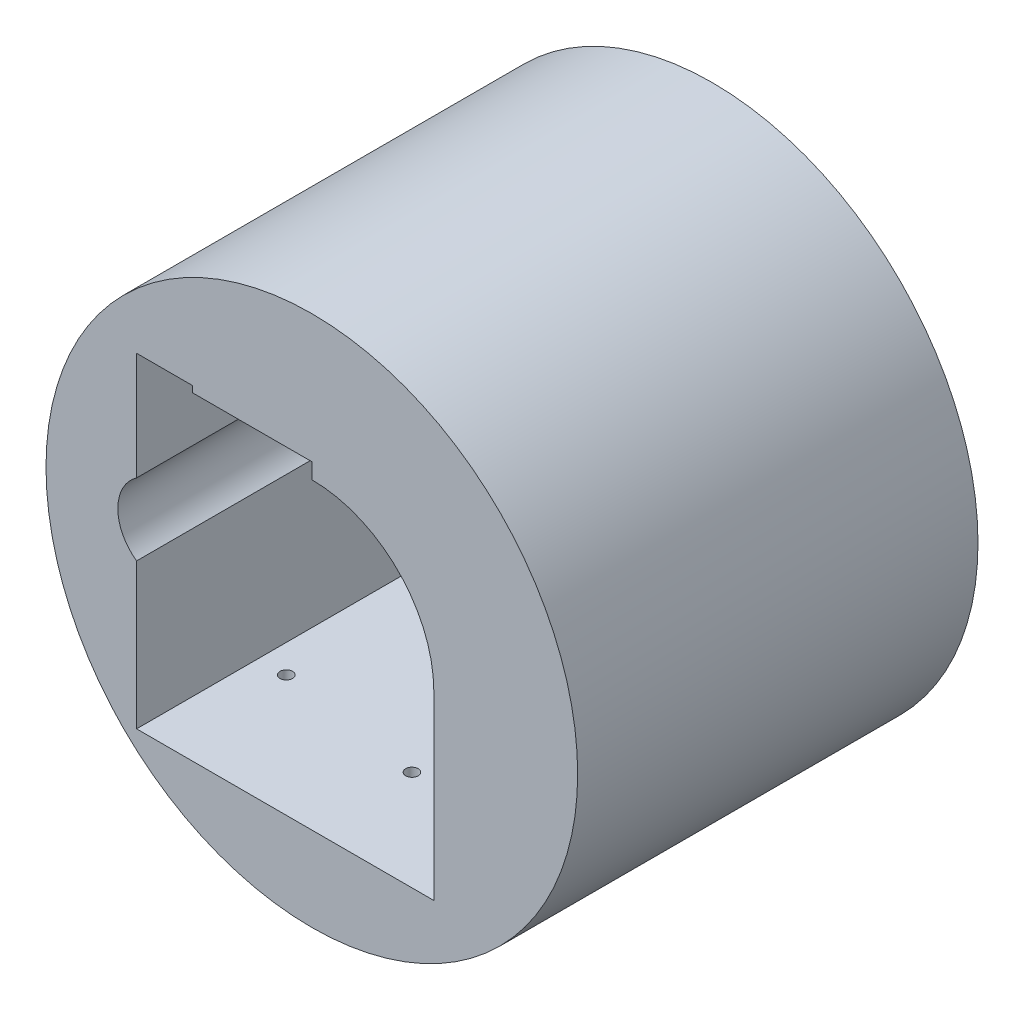
from build123d import *

# Parameters (mm, degrees)
SKETCH1_R           = 42.5
BOSS_EXTRUDE1_DEPTH = 64
SKETCH2_R           = 1
CUT_EXTRUDE1_DEPTH  = 13.5
SKETCH3_R           = 2.25
CUT_EXTRUDE2_DEPTH  = 5
SKETCH4_R           = 2.25
CUT_EXTRUDE3_DEPTH  = 12
CUT_EXTRUDE4_DEPTH  = 126.544655058


with BuildPart() as part:
    # Sketch1 → Boss-Extrude1 (new body)
    with BuildSketch(Plane(origin=(0, 0, -49.128748399), x_dir=(-1, 0, 0), z_dir=(0, 0, -1))):
        with Locations(Location((-41.816133513, 25, 0), (0, 0, 90))):
            Circle(SKETCH1_R)
        with BuildLine():
            Line((-13.801141106, 15.83484861), (-13.801141106, -4))
            Line((-13.801141106, -4), (-61.316133513, -4))
            Line((-61.316133513, -4), (-61.316133513, 25))
            ThreePointArc((-61.316133513, 25), (-55.604715746, 38.788582233), (-41.816133513, 44.5))
            Line((-41.816133513, 44.5), (-41.816133513, 47.000001781))
            Line((-41.816133513, 47.000001781), (-13.801141106, 47.000001781))
            Line((-13.801141106, 47.000001781), (-13.801141106, 34.16515139))
            Line((-13.801141106, 34.16515139), (-13.801141106, 30.744562647))
            ThreePointArc((-13.801141106, 30.744562647), (-10.801141106, 25), (-13.801141106, 19.255437353))
            Line((-13.801141106, 19.255437353), (-13.801141106, 15.83484861))
        make_face(mode=Mode.SUBTRACT)
    extrude(amount=-BOSS_EXTRUDE1_DEPTH)

    # Sketch2 → Cut-Extrude1 (cut)
    with BuildSketch(Plane(origin=(0, -17.5, 0), x_dir=(-1, 0, 0), z_dir=(0, -1, 0))):
        with Locations(Location((-18.301141106, 4.557815864, 0), (0, 0, 90))):
            Circle(SKETCH2_R)
        with Locations(Location((-18.301141106, 32.557815864, 0), (0, 0, 90))):
            Circle(SKETCH2_R)
        with Locations(Location((-41.816133513, 1.128748399, 0), (0, 0, 90))):
            Circle(SKETCH2_R)
    extrude(amount=-CUT_EXTRUDE1_DEPTH, mode=Mode.SUBTRACT)

    # Sketch3 → Cut-Extrude2 (cut)
    with BuildSketch(Plane(origin=(0, -17.5, 0), x_dir=(-1, 0, 0), z_dir=(0, -1, 0))):
        with Locations(Location((-41.816133513, 1.128748399, 0), (0, 0, 90))):
            Circle(SKETCH3_R)
        with Locations((-18.301141106, 4.557815864)):
            Circle(SKETCH3_R)
        with Locations((-18.301141106, 32.557815864)):
            Circle(SKETCH3_R)
    extrude(amount=-CUT_EXTRUDE2_DEPTH, mode=Mode.SUBTRACT)

    # Sketch4 → Cut-Extrude3 (cut)
    with BuildSketch(Plane(origin=(0, -17.5, 0), x_dir=(-1, 0, 0), z_dir=(0, -1, 0))):
        with Locations(Location((-18.301141106, 4.557815864, 0), (0, 0, 90))):
            Circle(SKETCH4_R)
        with Locations(Location((-18.301141106, 32.557815864, 0), (0, 0, 90))):
            Circle(SKETCH4_R)
    extrude(amount=-CUT_EXTRUDE3_DEPTH, mode=Mode.SUBTRACT)

    # Sketch5 → Cut-Extrude4 (cut, through all)
    with BuildSketch(Plane(origin=(0, 0, -49.128748399), x_dir=(-1, 0, 0), z_dir=(0, 0, -1))):
        Polygon((-21.801141106, 47.000001781), (-13.801141106, 47.000001781), (-13.801141106, 48.000001781), (-21.801141106, 48.000001781), (-22.748659585, 48.000001781), (-22.748659585, 47.000001781), align=None)
    extrude(amount=-CUT_EXTRUDE4_DEPTH, mode=Mode.SUBTRACT)


solid = part.part
